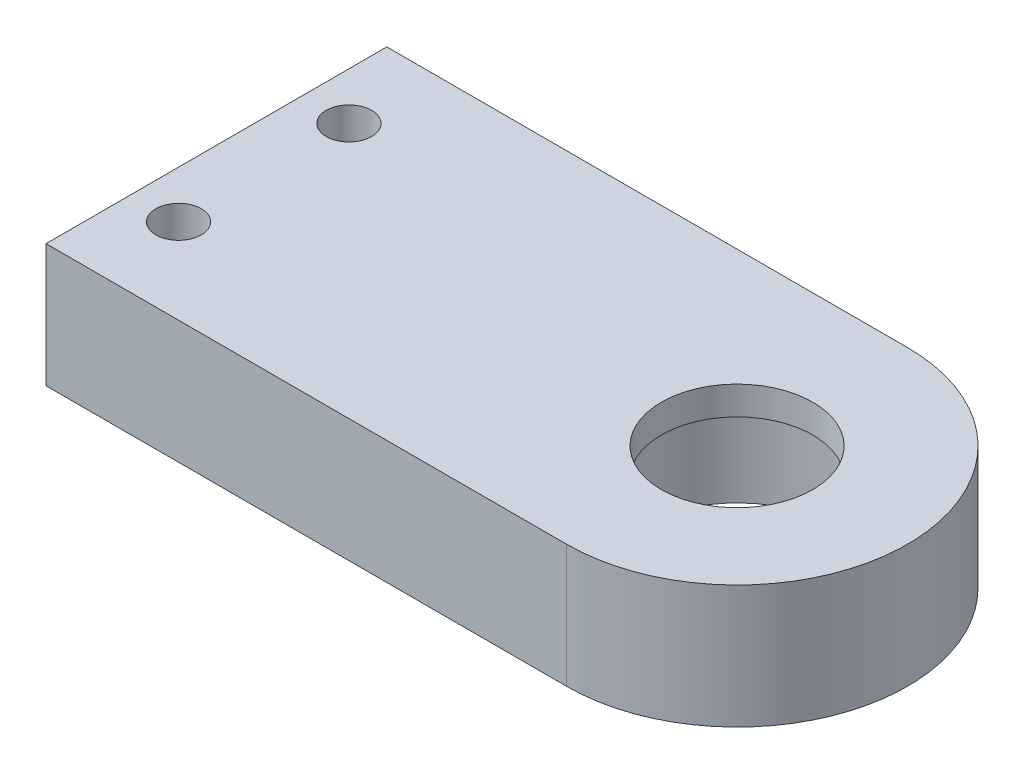
from build123d import *

# Parameters (mm, degrees)
BOSS_EXTRUDE1_DEPTH  = 6.5
SKETCH2_R            = 5.5
CUT_EXTRUDE2_DEPTH   = 5
SKETCH3_R            = 4
CUT_EXTRUDE4_DEPTH   = 1.5
M2_CLEARANCE_HOLE1_D = 2.4
M2_CLEARANCE_HOLE2_D = 2.4


with BuildPart() as part:
    # Sketch1 → Boss-Extrude1 (new body)
    with BuildSketch(Plane(origin=(0, 24.8, 0), x_dir=(1, 0, 0), z_dir=(0, 1, 0))):
        with BuildLine():
            Line((5.5, 9), (-22, 9))
            Line((-22, 9), (-22, -9))
            Line((-22, -9), (5.5, -9))
            ThreePointArc((5.5, -9), (14.5, 0), (5.5, 9))
        make_face()
    extrude(amount=BOSS_EXTRUDE1_DEPTH)

    # Sketch2 → Cut-Extrude2 (cut)
    with BuildSketch(Plane(origin=(0, 24.8, 0), x_dir=(1, 0, 0), z_dir=(0, 1, 0))):
        with Locations(Location((5.5, 0, 0), (0, 0, 270))):
            Circle(SKETCH2_R)
    extrude(amount=CUT_EXTRUDE2_DEPTH, mode=Mode.SUBTRACT)

    # Sketch3 → Cut-Extrude4 (cut)
    with BuildSketch(Plane(origin=(0, 29.8, 0), x_dir=(1, 0, 0), z_dir=(0, 1, 0))):
        with Locations(Location((5.5, 0, 0), (0, 0, 270))):
            Circle(SKETCH3_R)
    extrude(amount=CUT_EXTRUDE4_DEPTH, mode=Mode.SUBTRACT)

    # M2 Clearance Hole1 (through all)
    with Locations(Plane(origin=(0, 31.3, 0), x_dir=(1, 0, 0), z_dir=(0, 1, 0))):
        with Locations((-19.5, -4.5)):
            Hole(M2_CLEARANCE_HOLE1_D / 2)

    # M2 Clearance Hole2 (through all)
    with Locations(Plane(origin=(0, 31.3, 0), x_dir=(1, 0, 0), z_dir=(0, 1, 0))):
        with Locations((-19.5, 4.5)):
            Hole(M2_CLEARANCE_HOLE2_D / 2)


solid = part.part
